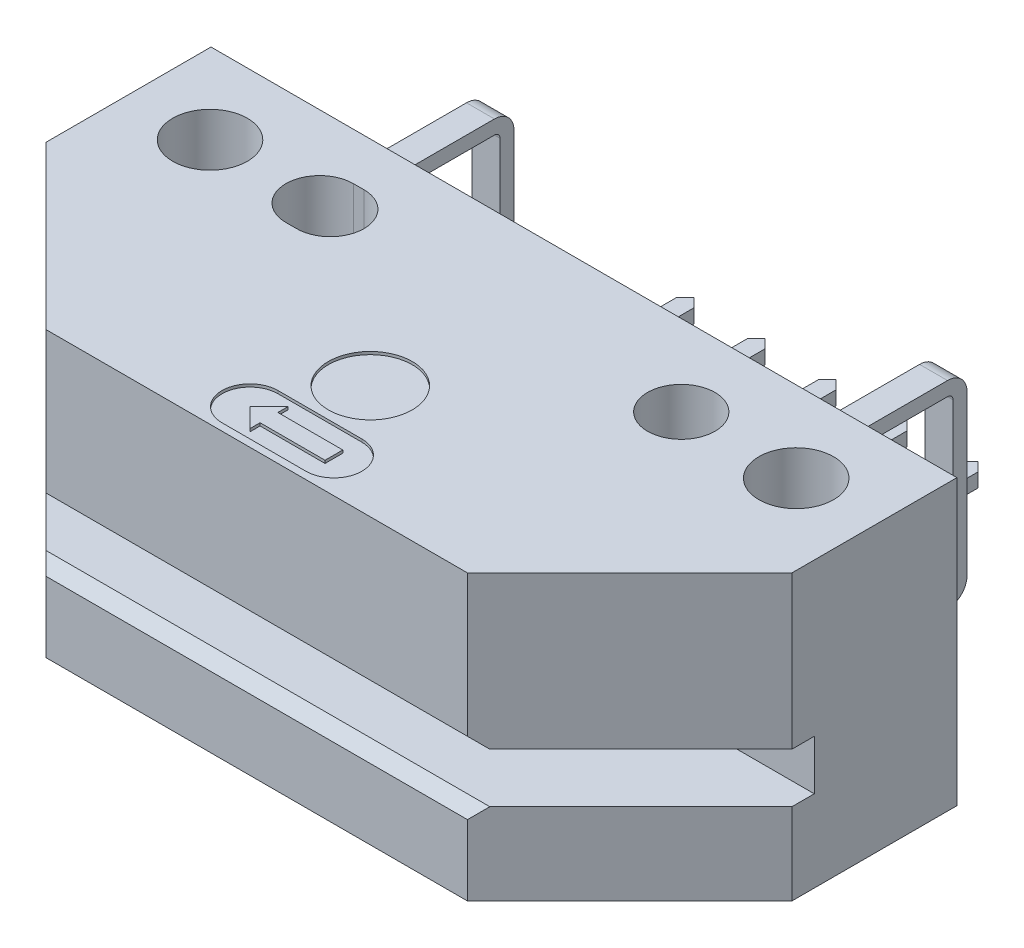
from build123d import *

# Parameters (mm, degrees)
BOSS_EXTRUDE1_DEPTH      = 5.46
BOSS_EXTRUDE1_DEPTH_BACK = 4.7
SKETCH1_R                = 1.335
SKETCH2_W                = 6.6
SKETCH2_H                = 1.78
CUT_EXTRUDE1_DEPTH       = 29.274902299
CHAMFER1_SIZE            = 0.4
SKETCH7_R                = 1.5
CUT_EXTRUDE4_DEPTH       = 0.1
CUT_EXTRUDE5_START       = -10.06
SKETCH7_2_R              = 1.5
CUT_EXTRUDE5_DEPTH       = 0.1
SKETCH3_R                = 1.205
CUT_EXTRUDE2_DEPTH       = 2.16
SKETCH4_R                = 1.205
CUT_EXTRUDE3_DEPTH       = 2.16
BOSS_EXTRUDE2_START      = -1.52
BOSS_EXTRUDE2_DEPTH      = 0.5
LPATTERN1_COUNT          = 3
LPATTERN1_PITCH          = 2.54
LPATTERN2_COUNT          = 3
LPATTERN2_PITCH          = 2.54
BOSS_EXTRUDE3_START      = 7.6
BOSS_EXTRUDE3_DEPTH      = 1
BOSS_EXTRUDE4_START      = -8.6
BOSS_EXTRUDE4_DEPTH      = 1


with BuildPart() as part:
    # Sketch1 → Boss-Extrude1 (new, two sides: drawn at the far end of the back side and taken through both)
    with BuildSketch(Plane(origin=(0, 0, 0), x_dir=(1, 0, 0), z_dir=(0, 1, 0)).offset(-BOSS_EXTRUDE1_DEPTH_BACK)):
        Polygon((-13.335, 7.64), (13.335, 7.64), (13.335, 1.74), (7.535, -4.06), (-7.535, -4.06), (-13.335, 1.74), align=None)
        with Locations(Location((10.48, 4.75, 0), (0, 0, 270))):
            Circle(SKETCH1_R, mode=Mode.SUBTRACT)
        with Locations(Location((-10.48, 4.75, 0), (0, 0, 270))):
            Circle(SKETCH1_R, mode=Mode.SUBTRACT)
    extrude(amount=BOSS_EXTRUDE1_DEPTH + BOSS_EXTRUDE1_DEPTH_BACK)

    # Sketch2 → Cut-Extrude1 (cut, through all)
    with BuildSketch(Plane.ZY.offset(13.335)):
        with Locations((0.76, -0.89)):
            Rectangle(SKETCH2_W, SKETCH2_H)
    extrude(amount=-CUT_EXTRUDE1_DEPTH, mode=Mode.SUBTRACT)

    # Chamfer1
    chamfer1_edges = [part.edges().sort_by_distance(p)[0] for p in [
        (0, 0, 4.06),
        (0, -1.78, 4.06),
    ]]
    chamfer(chamfer1_edges, length=CHAMFER1_SIZE)

    # Sketch7 → Cut-Extrude4 (cut)
    # profile 1 of 2: a face of its own
    with BuildSketch(Plane(origin=(0, 5.46, 0), x_dir=(1, 0, 0), z_dir=(0, 1, 0))):
        with Locations(Location((0, 0, 0), (0, 0, 270))):
            Circle(SKETCH7_R)
    # profile 2 of 2: a face of its own
    with BuildSketch(Plane(origin=(0, 5.46, 0), x_dir=(1, 0, 0), z_dir=(0, 1, 0))):
        with BuildLine():
            Line((-1.5, -1.8), (1.5, -1.8))
            ThreePointArc((1.5, -1.8), (2.5, -2.8), (1.5, -3.8))
            Line((1.5, -3.8), (-1.5, -3.8))
            ThreePointArc((-1.5, -3.8), (-2.5, -2.8), (-1.5, -1.8))
        make_face()
        Polygon((-1.5, -2.8), (-0.82259388, -2.12259388), (-0.82259388, -2.482222738), (1.5, -2.482222738), (1.5, -3.117777262), (-0.82259388, -3.117777262), (-0.82259388, -3.47740612), align=None, mode=Mode.SUBTRACT)
    extrude(amount=-CUT_EXTRUDE4_DEPTH, mode=Mode.SUBTRACT)

    # Sketch7<2> → Cut-Extrude5 (cut)
    # profile 1 of 2: a face of its own
    with BuildSketch(Plane(origin=(0, 5.46, 0), x_dir=(1, 0, 0), z_dir=(0, 1, 0)).offset(CUT_EXTRUDE5_START)):
        with Locations(Location((0, 0, 0), (0, 0, 270))):
            Circle(SKETCH7_2_R)
    # profile 2 of 2: a face of its own
    with BuildSketch(Plane(origin=(0, 5.46, 0), x_dir=(1, 0, 0), z_dir=(0, 1, 0)).offset(CUT_EXTRUDE5_START)):
        with BuildLine():
            Line((-1.5, -1.8), (1.5, -1.8))
            ThreePointArc((1.5, -1.8), (2.5, -2.8), (1.5, -3.8))
            Line((1.5, -3.8), (-1.5, -3.8))
            ThreePointArc((-1.5, -3.8), (-2.5, -2.8), (-1.5, -1.8))
        make_face()
        Polygon((-1.5, -2.8), (-0.82259388, -2.12259388), (-0.82259388, -2.482222738), (1.5, -2.482222738), (1.5, -3.117777262), (-0.82259388, -3.117777262), (-0.82259388, -3.47740612), align=None, mode=Mode.SUBTRACT)
    extrude(amount=-CUT_EXTRUDE5_DEPTH, mode=Mode.SUBTRACT)

    # Sketch3 → Cut-Extrude2 (cut)
    with BuildSketch(Plane(origin=(0, 5.46, 0), x_dir=(1, 0, 0), z_dir=(0, 1, 0))):
        with Locations(Location((6.37, 4.75, 0), (0, 0, 270))):
            Circle(SKETCH3_R)
        with BuildLine():
            Line((-6.56, 5.955), (-6.18, 5.955))
            ThreePointArc((-6.18, 5.955), (-4.975, 4.75), (-6.18, 3.545))
            Line((-6.18, 3.545), (-6.56, 3.545))
            ThreePointArc((-6.56, 3.545), (-7.765, 4.75), (-6.56, 5.955))
        make_face()
    extrude(amount=-CUT_EXTRUDE2_DEPTH, mode=Mode.SUBTRACT)

    # Sketch4 → Cut-Extrude3 (cut)
    with BuildSketch(Plane.XZ.offset(4.7)):
        with Locations(Location((8.635, -1.02, 0), (0, 0, 270))):
            Circle(SKETCH4_R)
        with BuildLine():
            Line((-8.825, 0.185), (-8.445, 0.185))
            ThreePointArc((-8.445, 0.185), (-7.24, -1.02), (-8.445, -2.225))
            Line((-8.445, -2.225), (-8.825, -2.225))
            ThreePointArc((-8.825, -2.225), (-10.03, -1.02), (-8.825, 0.185))
        make_face()
    extrude(amount=-CUT_EXTRUDE3_DEPTH, mode=Mode.SUBTRACT)

    # Sketch5 → Boss-Extrude2 (add)
    with BuildSketch(Plane.XZ.offset(4.7).offset(BOSS_EXTRUDE2_START)):
        Polygon((-0.625, -7.64), (-0.625, -9.440000013), (-0.314999987, -9.749999974), (-0.314999987, -16.335000065), (0, -16.65), (0.315000013, -16.335000091), (0.315000013, -9.75), (0.625, -9.440000013), (0.625, -7.64), align=None)
    boss_extrude2 = extrude(amount=-BOSS_EXTRUDE2_DEPTH)

    # LPattern1: Boss-Extrude2 ×3
    with Locations(*[(i * LPATTERN1_PITCH, 0, 0) for i in range(1, LPATTERN1_COUNT)]):
        add(boss_extrude2)

    # LPattern2: Boss-Extrude2 ×3
    with Locations(*[(-i * LPATTERN2_PITCH, 0, 0) for i in range(1, LPATTERN2_COUNT)]):
        add(boss_extrude2)

    # Sketch6 → Boss-Extrude3 (add)
    with BuildSketch(Plane(origin=(0, 0, 0), x_dir=(0, 0, -1), z_dir=(1, 0, 0)).offset(BOSS_EXTRUDE3_START)):
        with BuildLine():
            Line((7.64, -3.18), (12.04, -3.18))
            ThreePointArc((12.04, -3.18), (12.534974747, -2.974974747), (12.74, -2.48))
            Line((12.74, -2.48), (12.74, 3.2))
            ThreePointArc((12.74, 3.2), (12.534974747, 3.694974747), (12.04, 3.9))
            Line((12.04, 3.9), (7.64, 3.9))
            Line((7.64, 3.9), (7.64, 3.4))
            Line((7.64, 3.4), (12.04, 3.4))
            ThreePointArc((12.04, 3.4), (12.181421356, 3.341421356), (12.24, 3.2))
            Line((12.24, 3.2), (12.24, -2.48))
            ThreePointArc((12.24, -2.48), (12.181421356, -2.621421356), (12.04, -2.68))
            Line((12.04, -2.68), (7.64, -2.68))
            Line((7.64, -2.68), (7.64, -3.18))
        make_face()
    extrude(amount=BOSS_EXTRUDE3_DEPTH)

    # Sketch6<2> → Boss-Extrude4 (add)
    with BuildSketch(Plane(origin=(0, 0, 0), x_dir=(0, 0, -1), z_dir=(1, 0, 0)).offset(BOSS_EXTRUDE4_START)):
        with BuildLine():
            Line((7.64, -3.18), (12.04, -3.18))
            ThreePointArc((12.04, -3.18), (12.534974747, -2.974974747), (12.74, -2.48))
            Line((12.74, -2.48), (12.74, 3.2))
            ThreePointArc((12.74, 3.2), (12.534974747, 3.694974747), (12.04, 3.9))
            Line((12.04, 3.9), (7.64, 3.9))
            Line((7.64, 3.9), (7.64, 3.4))
            Line((7.64, 3.4), (12.04, 3.4))
            ThreePointArc((12.04, 3.4), (12.181421356, 3.341421356), (12.24, 3.2))
            Line((12.24, 3.2), (12.24, -2.48))
            ThreePointArc((12.24, -2.48), (12.181421356, -2.621421356), (12.04, -2.68))
            Line((12.04, -2.68), (7.64, -2.68))
            Line((7.64, -2.68), (7.64, -3.18))
        make_face()
    extrude(amount=BOSS_EXTRUDE4_DEPTH)


solid = part.part
